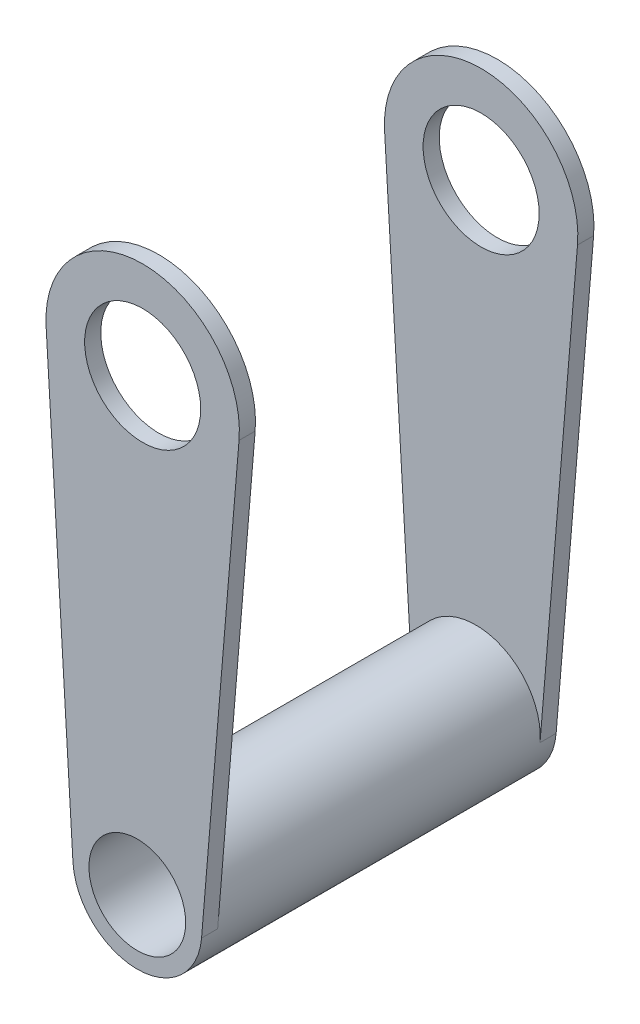
from build123d import *

# Parameters (mm, degrees)
EXTRUDE_START   = -25
SKETCH_1_R      = 9
SKETCH_1_R_2    = 7.5
EXTRUDE_1_DEPTH = 2.5
SKETCH_5_R      = 10
SKETCH_5_R_2    = 7.5
EXTRUDE_5_DEPTH = 27.5
EXTRUDE_START_2 = 27.5
SKETCH_1_3_R    = 9
SKETCH_1_3_R_2  = 7.5
EXTRUDE_6_DEPTH = 2.5


with BuildPart() as part:
    # 草圖1 → 填料-伸長1 (new body)
    with BuildSketch(Plane.XY.offset(EXTRUDE_START)):
        with BuildLine():
            Line((132.302720539, 75.19843017), (136.463425545, 5.322192908))
            ThreePointArc((136.463425545, 5.322192908), (146.327410245, -4.082720481), (156.411202737, 5.086124539))
            Line((156.411202737, 5.086124539), (162.224386326, 74.844327616))
            ThreePointArc((162.224386326, 74.844327616), (147.453702316, 91.088959541), (132.302720539, 75.19843017))
        make_face()
        with Locations((147.276199953, 76.090009814)):
            Circle(SKETCH_1_R, mode=Mode.SUBTRACT)
        with Locations((146.445745154, 5.916579337)):
            Circle(SKETCH_1_R_2, mode=Mode.SUBTRACT)
    extrude(amount=-EXTRUDE_1_DEPTH)

    # 草圖5 → 填料-伸長5 (add, symmetric)
    with BuildSketch(Plane.XY):
        with Locations((146.445745154, 5.916579337)):
            Circle(SKETCH_5_R)
        with Locations((146.445745154, 5.916579337)):
            Circle(SKETCH_5_R_2, mode=Mode.SUBTRACT)
    extrude(amount=EXTRUDE_5_DEPTH, both=True)

    # 草圖1<3> → 填料-伸長6 (add)
    with BuildSketch(Plane.XY.offset(EXTRUDE_START_2)):
        with BuildLine():
            Line((132.302720539, 75.19843017), (136.463425545, 5.322192908))
            ThreePointArc((136.463425545, 5.322192908), (146.327410245, -4.082720481), (156.411202737, 5.086124539))
            Line((156.411202737, 5.086124539), (162.224386326, 74.844327616))
            ThreePointArc((162.224386326, 74.844327616), (147.453702316, 91.088959541), (132.302720539, 75.19843017))
        make_face()
        with Locations((147.276199953, 76.090009814)):
            Circle(SKETCH_1_3_R, mode=Mode.SUBTRACT)
        with Locations((146.445745154, 5.916579337)):
            Circle(SKETCH_1_3_R_2, mode=Mode.SUBTRACT)
    extrude(amount=-EXTRUDE_6_DEPTH)


solid = part.part
